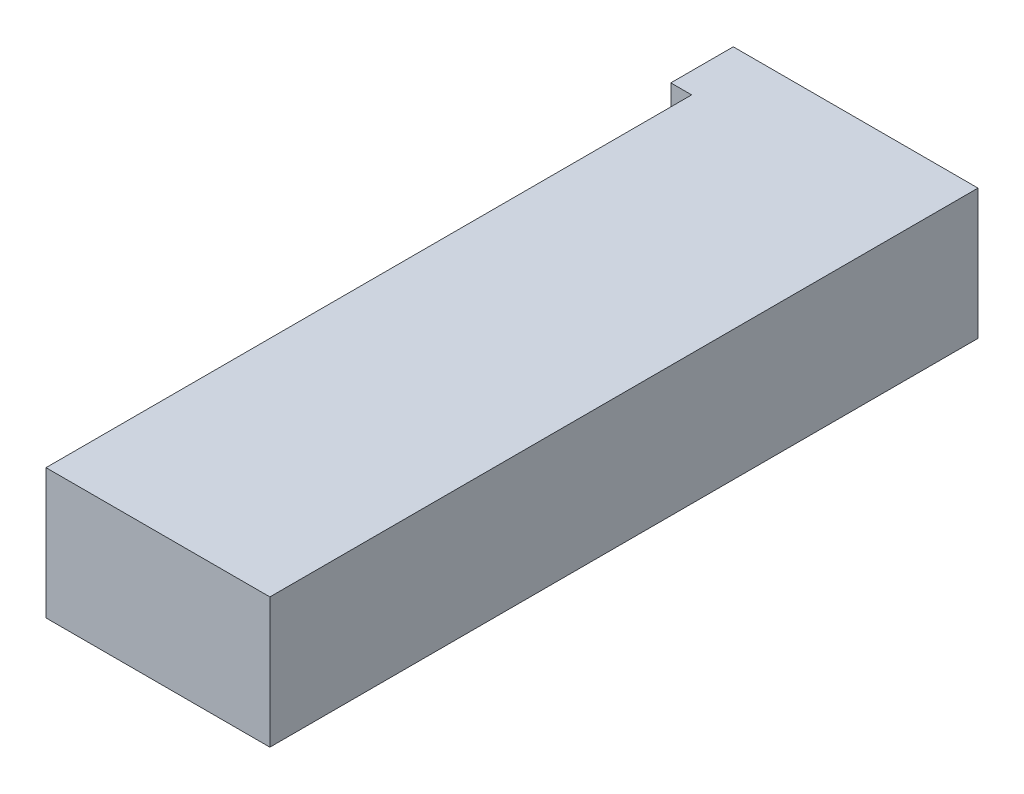
from build123d import *

# Parameters (mm, degrees)
CROQUIS1_W              = 43
CROQUIS1_H              = 12
CROQUIS1_H_2            = 124
CROQUIS1_W_2            = 4
SALIENTE_EXTRUIR1_DEPTH = 25


with BuildPart() as part:
    # Croquis1 → Saliente-Extruir1 (new body)
    with BuildSketch(Plane(origin=(0, 0, 0), x_dir=(1, 0, 0), z_dir=(0, 1, 0))):
        with Locations((0, 62)):
            Rectangle(CROQUIS1_W, CROQUIS1_H)
        with Locations((0, -6)):
            Rectangle(CROQUIS1_W, CROQUIS1_H_2)
        with Locations((-23.5, 62)):
            Rectangle(CROQUIS1_W_2, CROQUIS1_H)
    extrude(amount=SALIENTE_EXTRUIR1_DEPTH)


solid = part.part
